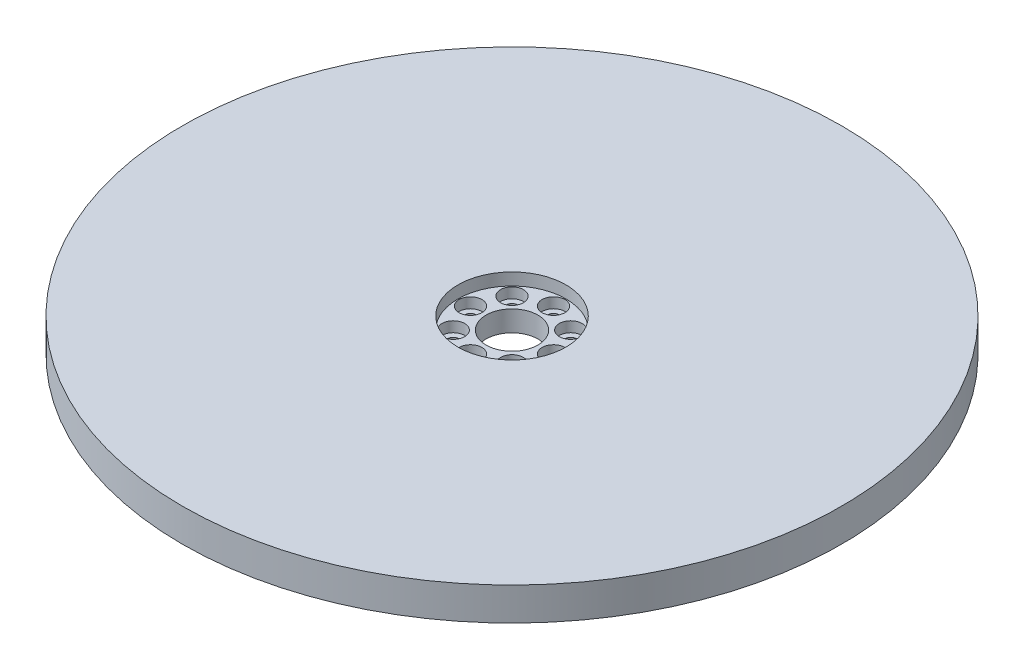
from build123d import *

# Parameters (mm, degrees)
SKETCH1_R                      = 63.5
BOSS_EXTRUDE1_DEPTH            = 3.175
SKETCH2_R                      = 12.9
BOSS_EXTRUDE2_DEPTH            = 3.175
BOSS_EXTRUDE3_START            = 3.175
SKETCH3_R                      = 63.5
SKETCH3_R_2                    = 25.4
BOSS_EXTRUDE3_DEPTH            = 3.175
SKETCH5_R                      = 10.4
CUT_EXTRUDE1_DEPTH             = 2.35
SKETCH6_R                      = 5
CUT_EXTRUDE2_DEPTH             = 4
CBORE_FOR_M2_SHCS1_D           = 2.2
CBORE_FOR_M2_SHCS1_DEPTH       = 6
CBORE_FOR_M2_SHCS1_CBORE_D     = 4.4
CBORE_FOR_M2_SHCS1_CBORE_DEPTH = 2
CBORE_FOR_M2_SHCS1_TIP         = 0.660946681


with BuildPart() as part:
    # Sketch1 → Boss-Extrude1 (new body)
    with BuildSketch(Plane(origin=(0, 0, 0), x_dir=(1, 0, 0), z_dir=(0, 1, 0))):
        with Locations(Location((0, 0, 0), (0, 0, 270))):
            Circle(SKETCH1_R)
    extrude(amount=BOSS_EXTRUDE1_DEPTH)

    # Sketch2 → Boss-Extrude2 (add)
    with BuildSketch(Plane.XZ):
        with Locations(Location((0, 0, 0), (0, 0, 270))):
            Circle(SKETCH2_R)
    extrude(amount=BOSS_EXTRUDE2_DEPTH)

    # Sketch3 → Boss-Extrude3 (add)
    with BuildSketch(Plane.XZ.offset(BOSS_EXTRUDE3_START)):
        with Locations(Location((0, 0, 0), (0, 0, 270))):
            Circle(SKETCH3_R)
        with Locations(Location((0, 0, 0), (0, 0, 270))):
            Circle(SKETCH3_R_2, mode=Mode.SUBTRACT)
    extrude(amount=-BOSS_EXTRUDE3_DEPTH)

    # Sketch5 → Cut-Extrude1 (cut)
    with BuildSketch(Plane(origin=(0, 3.175, 0), x_dir=(1, 0, 0), z_dir=(0, 1, 0))):
        with Locations(Location((0, 0, 0), (0, 0, 270))):
            Circle(SKETCH5_R)
    extrude(amount=-CUT_EXTRUDE1_DEPTH, mode=Mode.SUBTRACT)

    # Sketch6 → Cut-Extrude2 (cut)
    with BuildSketch(Plane(origin=(0, 0.825, 0), x_dir=(1, 0, 0), z_dir=(0, 1, 0))):
        with Locations(Location((0, 0, 0), (0, 0, 270))):
            Circle(SKETCH6_R)
    extrude(amount=-CUT_EXTRUDE2_DEPTH, mode=Mode.SUBTRACT)

    # CBORE for M2 SHCS1
    with Locations(Plane(origin=(0, 0.825, 0), x_dir=(1, 0, 0), z_dir=(0, 1, 0))):
        with Locations((-5.65685425, 5.65685425), (0, 8), (5.65685425, 5.65685425), (8, 0), (5.65685425, -5.65685425), (0, -8), (-5.65685425, -5.65685425), (-8, 0)):
            CounterBoreHole(CBORE_FOR_M2_SHCS1_D / 2, CBORE_FOR_M2_SHCS1_CBORE_D / 2, CBORE_FOR_M2_SHCS1_CBORE_DEPTH, depth=CBORE_FOR_M2_SHCS1_DEPTH)
            with Locations((0, 0, -(CBORE_FOR_M2_SHCS1_DEPTH + CBORE_FOR_M2_SHCS1_TIP / 2))):  # 118° drill point
                Cone(0, CBORE_FOR_M2_SHCS1_D / 2, CBORE_FOR_M2_SHCS1_TIP, mode=Mode.SUBTRACT)


solid = part.part
